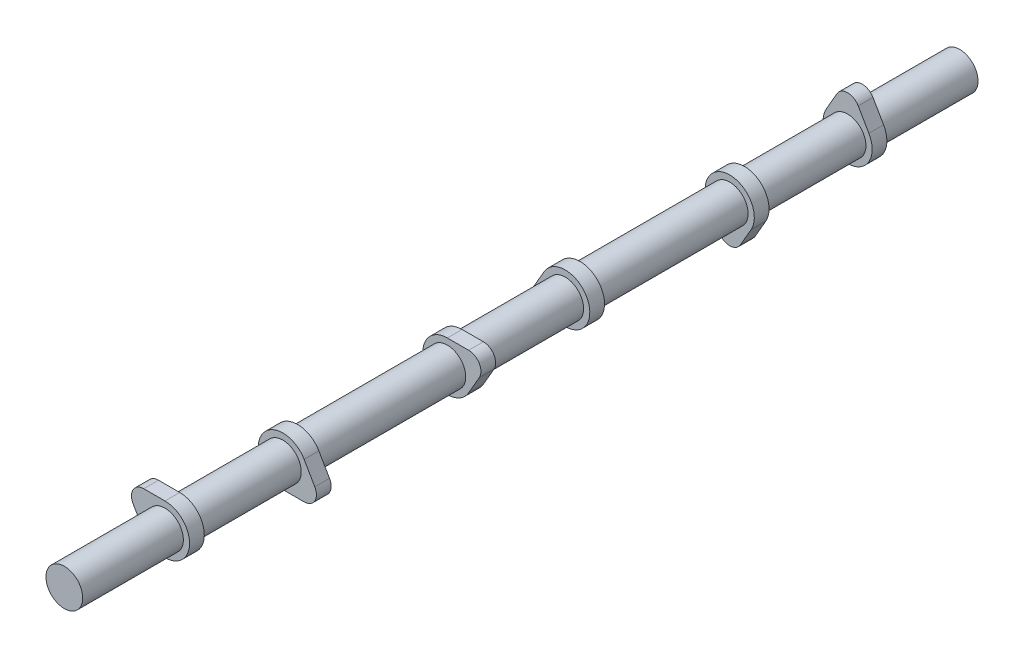
from build123d import *

# Parameters (mm, degrees)
BOSS_EXTRUDE1_DEPTH   = 7.62
BODY_MOVE_COPY2_ANGLE = 180
BOSS_EXTRUDE2_START   = -25.4
SKETCH2_R             = 9.5
BOSS_EXTRUDE2_DEPTH   = 146.05
LPATTERN1_COUNT       = 3
LPATTERN1_PITCH       = 146.05
BODY_MOVE_COPY3_ANGLE = 120
BODY_MOVE_COPY4_ANGLE = 120
BOSS_EXTRUDE3_START   = 24.94
SKETCH3_R             = 9.5
BOSS_EXTRUDE3_DEPTH   = 24.94


with BuildPart() as part:
    # Sketch1 → Boss-Extrude1 (new body)
    with BuildSketch(Plane.XY):
        with BuildLine():
            Line((-5.499261314, 15.875), (-10.998522628, 6.35))
            ThreePointArc((-10.998522628, 6.35), (0, -12.7), (10.998522628, 6.35))
            Line((10.998522628, 6.35), (5.499261314, 15.875))
            ThreePointArc((5.499261314, 15.875), (0, 19.05), (-5.499261314, 15.875))
        make_face()
    extrude(amount=BOSS_EXTRUDE1_DEPTH)


with BuildPart() as body_2:
    # Body-Move/Copy1: copy of part
    add(part.part.moved(Location((0, 0, 60.96))))


with BuildPart() as body_2_1:
    # Body-Move/Copy2: moved
    add(body_2.part.rotate(Axis((0, 0, 0), (0, 0, 1)), BODY_MOVE_COPY2_ANGLE))


with BuildPart() as part_1:
    add(part.part)

    add(body_2_1.part)  # Boss-Extrude2 merges body 2
    # Sketch2 → Boss-Extrude2 (add)
    with BuildSketch(Plane.XY.offset(BOSS_EXTRUDE2_START)):
        Circle(SKETCH2_R)
    extrude(amount=BOSS_EXTRUDE2_DEPTH)


with BuildPart() as lpattern1_1:
    # LPattern1: pattern copy
    add(part_1.part.moved(Location(Vector(0, 0, 1) * (1 * LPATTERN1_PITCH))))


with BuildPart() as lpattern1_2:
    # LPattern1: pattern copy
    add(part_1.part.moved(Location(Vector(0, 0, 1) * (2 * LPATTERN1_PITCH))))


with BuildPart() as lpattern1_1_1:
    # Body-Move/Copy3: moved
    add(lpattern1_1.part.rotate(Axis((0, 0, 0), (0, 0, 1)), BODY_MOVE_COPY3_ANGLE))


with BuildPart() as lpattern1_2_1:
    # Body-Move/Copy4: moved
    add(lpattern1_2.part.rotate(Axis((0, 0, 0), (0, 0, -1)), BODY_MOVE_COPY4_ANGLE))


with BuildPart() as part_2:
    add(part_1.part)

    # Sketch3 → Boss-Extrude3 (add)
    with BuildSketch(Plane(origin=(0, 0, -25.4), x_dir=(-1, 0, 0), z_dir=(0, 0, -1)).offset(BOSS_EXTRUDE3_START)):
        Circle(SKETCH3_R)
    extrude(amount=-BOSS_EXTRUDE3_DEPTH)


with BuildPart() as lpattern1_2_2:
    add(lpattern1_2_1.part)

    # Combine1: union LPattern1_1, part
    add(lpattern1_1_1.part)
    add(part_2.part)


solid = lpattern1_2_2.part
